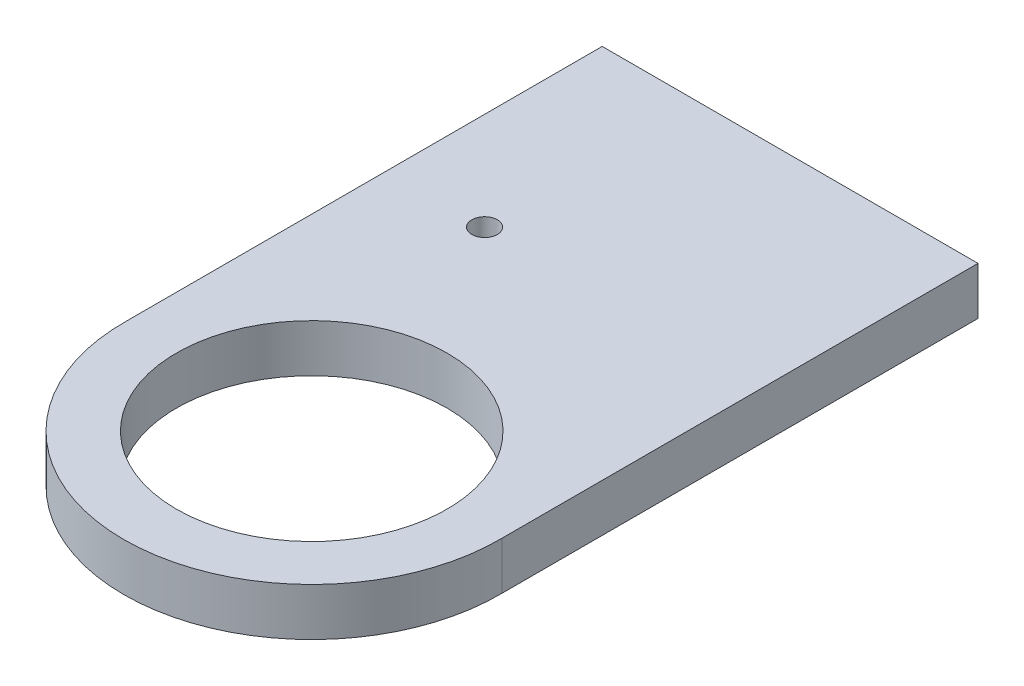
from build123d import *

# Parameters (mm, degrees)
PARED_START                = 21.5
SK_PARED_W                 = 50
SK_PARED_H                 = 63.3
PARED_DEPTH                = 6.35
CABEZA_START               = 21.5
SK_CABEZA_R                = 25
CABEZA_DEPTH               = 6.35
PASO_CUBO_J5_START         = 21.5
SK_PASO_CUBO_J5_R          = 18
PASO_CUBO_J5_DEPTH         = 6.35
PASANTE_M3_CINCHO_START    = 21.5
SK_PASANTE_M3_CINCHO_R     = 1.7
PASANTE_M3_CINCHO_DEPTH    = 6.35
SK_ROSCA_M3_DESDE_ABAJO_R  = 1.25
ROSCA_M3_DESDE_ABAJO_DEPTH = 9


with BuildPart() as part:
    # Sk_Pared → Pared (new body)
    with BuildSketch(Plane(origin=(0, 0, 0), x_dir=(1, 0, 0), z_dir=(0, 1, 0)).offset(PARED_START)):
        with Locations((0, -458)):
            Rectangle(SK_PARED_W, SK_PARED_H)
    extrude(amount=PARED_DEPTH)

    # Sk_Cabeza → Cabeza (add)
    with BuildSketch(Plane(origin=(0, 0, 0), x_dir=(1, 0, 0), z_dir=(0, 1, 0)).offset(CABEZA_START)):
        with Locations((0, -490)):
            Circle(SK_CABEZA_R)
    extrude(amount=CABEZA_DEPTH)

    # Sk_Paso_cubo_J5 → Paso_cubo_J5 (cut)
    with BuildSketch(Plane(origin=(0, 0, 0), x_dir=(1, 0, 0), z_dir=(0, 1, 0)).offset(PASO_CUBO_J5_START)):
        with Locations(Location((0, -490, 0), (0, 0, 270))):
            Circle(SK_PASO_CUBO_J5_R)
    extrude(amount=PASO_CUBO_J5_DEPTH, mode=Mode.SUBTRACT)

    # Sk_Pasante_M3_cincho → Pasante_M3_cincho (cut)
    with BuildSketch(Plane(origin=(0, 0, 0), x_dir=(1, 0, 0), z_dir=(0, 1, 0)).offset(PASANTE_M3_CINCHO_START)):
        with Locations(Location((-12, -455, 0), (0, 0, 270))):
            Circle(SK_PASANTE_M3_CINCHO_R)
    extrude(amount=PASANTE_M3_CINCHO_DEPTH, mode=Mode.SUBTRACT)

    # Sk_Rosca_M3_desde_abajo → Rosca_M3_desde_abajo (cut)
    with BuildSketch(Plane(origin=(0, 0, 426.35), x_dir=(-1, 0, 0), z_dir=(0, 0, -1))):
        with Locations((15, 24.675)):
            Circle(SK_ROSCA_M3_DESDE_ABAJO_R)
        with Locations((-15, 24.675)):
            Circle(SK_ROSCA_M3_DESDE_ABAJO_R)
    extrude(amount=-ROSCA_M3_DESDE_ABAJO_DEPTH, mode=Mode.SUBTRACT)


solid = part.part
